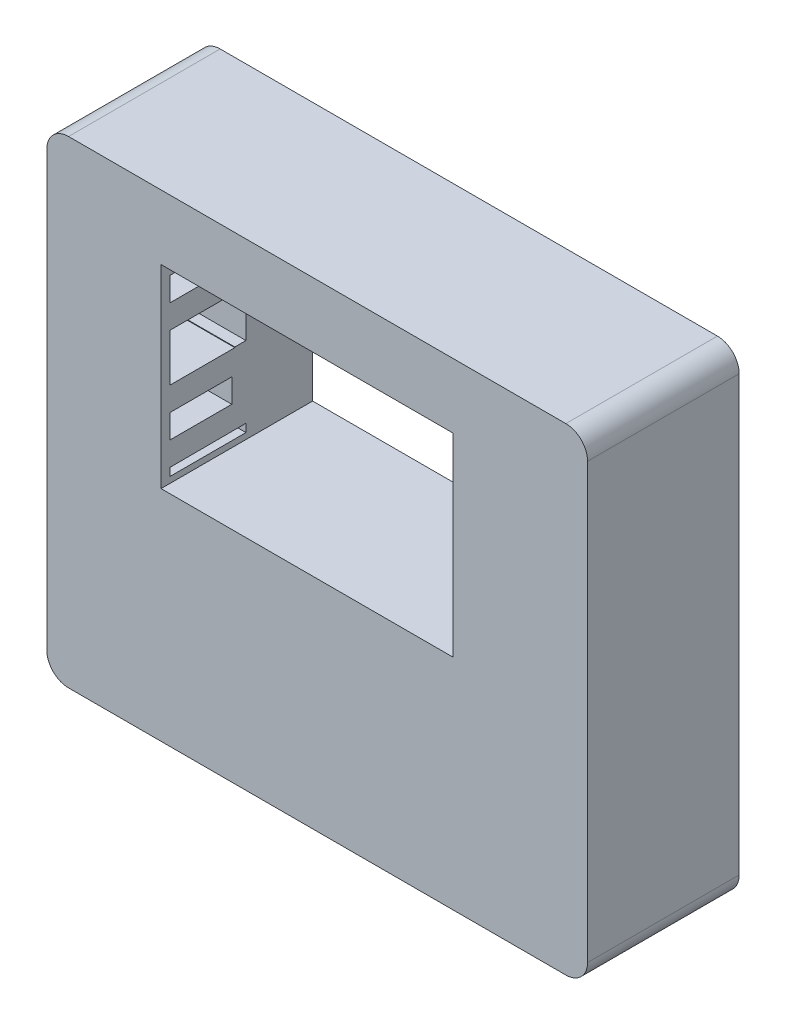
from build123d import *

# Parameters (mm, degrees)
SKETCH1_W           = 57.8
SKETCH1_H           = 38.4
BOSS_EXTRUDE1_DEPTH = 30
SKETCH2_W           = 8.89
SKETCH2_H           = 3.43
SKETCH2_W_2         = 14.05
SKETCH2_H_2         = 16.84
SKETCH2_W_3         = 17.696
SKETCH2_H_3         = 6.81
SKETCH2_W_4         = 9.3
SKETCH2_H_4         = 11
CUT_EXTRUDE1_DEPTH  = 23
SKETCH3_W           = 12.2
SKETCH3_H           = 4.7
CUT_EXTRUDE2_DEPTH  = 23


with BuildPart() as part:
    # Sketch1 → Boss-Extrude1 (new body)
    with BuildSketch(Plane.XY):
        with BuildLine():
            Line((84, 51.09), (-14.4, 51.09))
            ThreePointArc((-14.4, 51.09), (-17.440559159, 49.830559159), (-18.7, 46.79))
            Line((-18.7, 46.79), (-18.7, -39.11))
            ThreePointArc((-18.7, -39.11), (-17.440559159, -42.150559159), (-14.4, -43.41))
            Line((-14.4, -43.41), (84, -43.41))
            ThreePointArc((84, -43.41), (87.040559159, -42.150559159), (88.3, -39.11))
            Line((88.3, -39.11), (88.3, 46.79))
            ThreePointArc((88.3, 46.79), (87.040559159, 49.830559159), (84, 51.09))
        make_face()
        with Locations((32.8, 19.1)):
            Rectangle(SKETCH1_W, SKETCH1_H, mode=Mode.SUBTRACT)
    extrude(amount=-BOSS_EXTRUDE1_DEPTH)

    # Sketch2 → Cut-Extrude1 (cut)
    with BuildSketch(Plane.XZ.offset(43.41)):
        with Locations((76.775, -26.5048)):
            Rectangle(SKETCH2_W, SKETCH2_H)
        Polygon((66.12, -28.296), (68.12, -28.296), (69.827, -28.296), (69.827, -14.646007205), (68.12, -14.646007205), (66.12, -14.646007205), (57.38, -14.646007205), (55.38, -14.646007205), (53.673, -14.646007205), (53.673, -28.296), (55.38, -28.296), (57.38, -28.296), align=None)
        with Locations((44.4, -19.7998)):
            Rectangle(SKETCH2_W_2, SKETCH2_H_2)
        with Locations((27.4, -19.7998)):
            Rectangle(SKETCH2_W_2, SKETCH2_H_2)
        with Locations((7.56, -24.8148)):
            Rectangle(SKETCH2_W_3, SKETCH2_H_3)
        with Locations((-9.2, -22.796)):
            Rectangle(SKETCH2_W_4, SKETCH2_H_4)
    extrude(amount=-CUT_EXTRUDE1_DEPTH, mode=Mode.SUBTRACT)

    # Sketch3 → Cut-Extrude2 (cut)
    with BuildSketch(Plane.ZY.offset(18.7)):
        with Locations((-7.9, 33.2)):
            Rectangle(SKETCH3_W, SKETCH3_H)
        Polygon((-16.8, 26.15), (-1.8, 26.15), (-1.8, 16.75), (-14.6, 16.75), (-14.6, 16.875), (-16.8, 16.875), align=None)
        with Locations((-7.9, 9.7)):
            Rectangle(SKETCH3_W, SKETCH3_H)
        Polygon((-1.8, 1.1), (-16.8, 1.1), (-16.8, 2.7), (-1.8, 2.65), align=None)
    extrude(amount=-CUT_EXTRUDE2_DEPTH, mode=Mode.SUBTRACT)


solid = part.part
